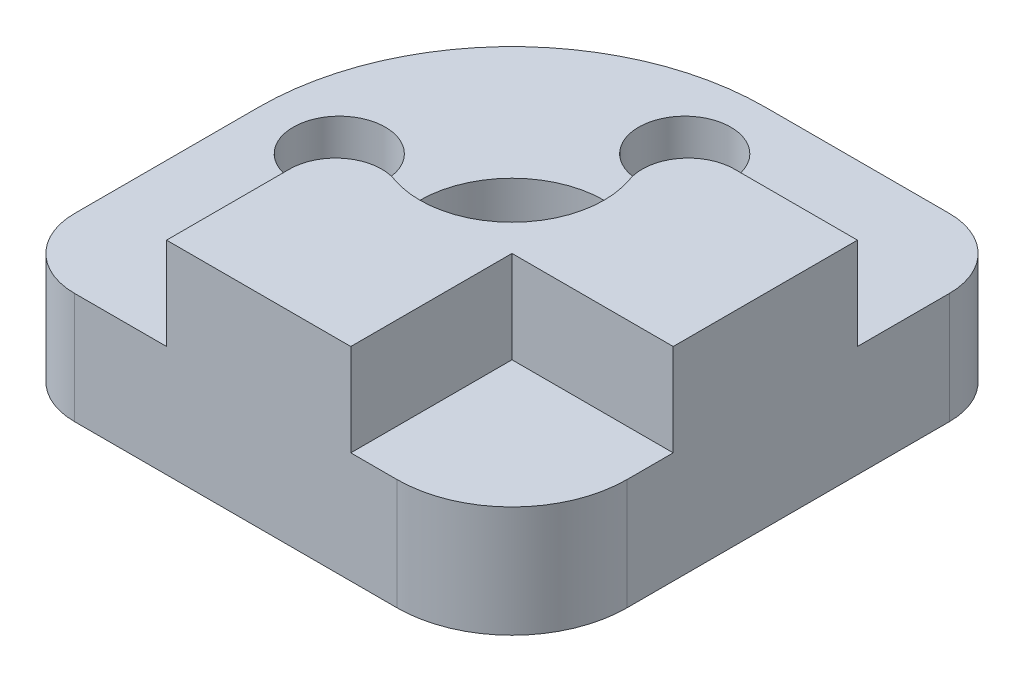
from build123d import *

# Parameters (mm, degrees)
SKETCH1_R           = 4
SKETCH1_R_2         = 2
BOSS_EXTRUDE1_DEPTH = 4.825
BOSS_EXTRUDE2_DEPTH = 4


with BuildPart() as part:
    # Sketch1 → Boss-Extrude1 (new body)
    with BuildSketch(Plane(origin=(0, 0, 0), x_dir=(1, 0, 0), z_dir=(0, 1, 0))):
        with BuildLine():
            Line((-11, 0), (-11, -8))
            ThreePointArc((-11, -8), (-10.121320344, -10.121320344), (-8, -11))
            Line((-8, -11), (6, -11))
            ThreePointArc((6, -11), (9.535533906, -9.535533906), (11, -6))
            Line((11, -6), (11, 8))
            ThreePointArc((11, 8), (10.121320344, 10.121320344), (8, 11))
            Line((8, 11), (0, 11))
            ThreePointArc((0, 11), (-7.778174593, 7.778174593), (-11, 0))
        make_face()
        with Locations(Location((0, 0, 0), (0, 0, 270))):
            Circle(SKETCH1_R, mode=Mode.SUBTRACT)
        with Locations(Location((-7.5, 0, 0), (0, 0, 270))):
            Circle(SKETCH1_R_2, mode=Mode.SUBTRACT)
        with Locations(Location((0, 7.5, 0), (0, 0, 270))):
            Circle(SKETCH1_R_2, mode=Mode.SUBTRACT)
    extrude(amount=BOSS_EXTRUDE1_DEPTH)

    # Sketch2 → Boss-Extrude2 (add)
    with BuildSketch(Plane(origin=(0, 4.825, 0), x_dir=(1, 0, 0), z_dir=(0, 1, 0))):
        with BuildLine():
            Line((4, -11), (4, -4))
            Line((4, -4), (11, -4))
            Line((11, -4), (11, 4))
            Line((11, 4), (5.656854249, 4))
            ThreePointArc((5.656854249, 4), (4.023861088, 3.154700538), (3.771236166, 1.333333333))
            ThreePointArc((3.771236166, 1.333333333), (2.828427125, -2.828427125), (-1.333333333, -3.771236166))
            ThreePointArc((-1.333333333, -3.771236166), (-3.154700538, -4.023861088), (-4, -5.656854249))
            Line((-4, -5.656854249), (-4, -11))
            Line((-4, -11), (4, -11))
        make_face()
    extrude(amount=BOSS_EXTRUDE2_DEPTH)


solid = part.part
